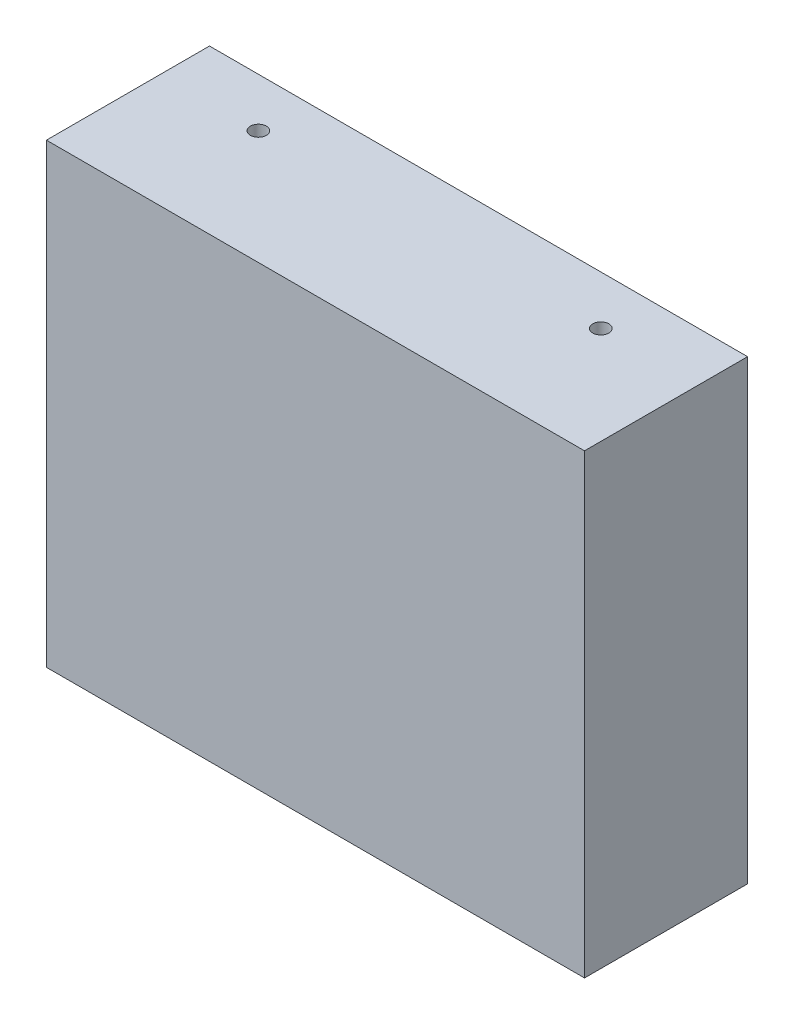
from build123d import *

# Parameters (mm, degrees)
SKETCH1_W              = 838.2
SKETCH1_H              = 711.2
BOSS_EXTRUDE1_DEPTH    = 254
F_25_0MM_DOWEL_HOLE1_D = 25


with BuildPart() as part:
    # Sketch1 → Boss-Extrude1 (new body)
    with BuildSketch(Plane.XY):
        Rectangle(SKETCH1_W, SKETCH1_H)
    extrude(amount=BOSS_EXTRUDE1_DEPTH)

    # Ø25.0mm Dowel Hole1 (through all)
    with Locations(Plane(origin=(0, -355.6, 0), x_dir=(-1, 0, 0), z_dir=(0, -1, 0))):
        with Locations((266.7, -76.2), (-266.7, -76.2)):
            Hole(F_25_0MM_DOWEL_HOLE1_D / 2)


solid = part.part
